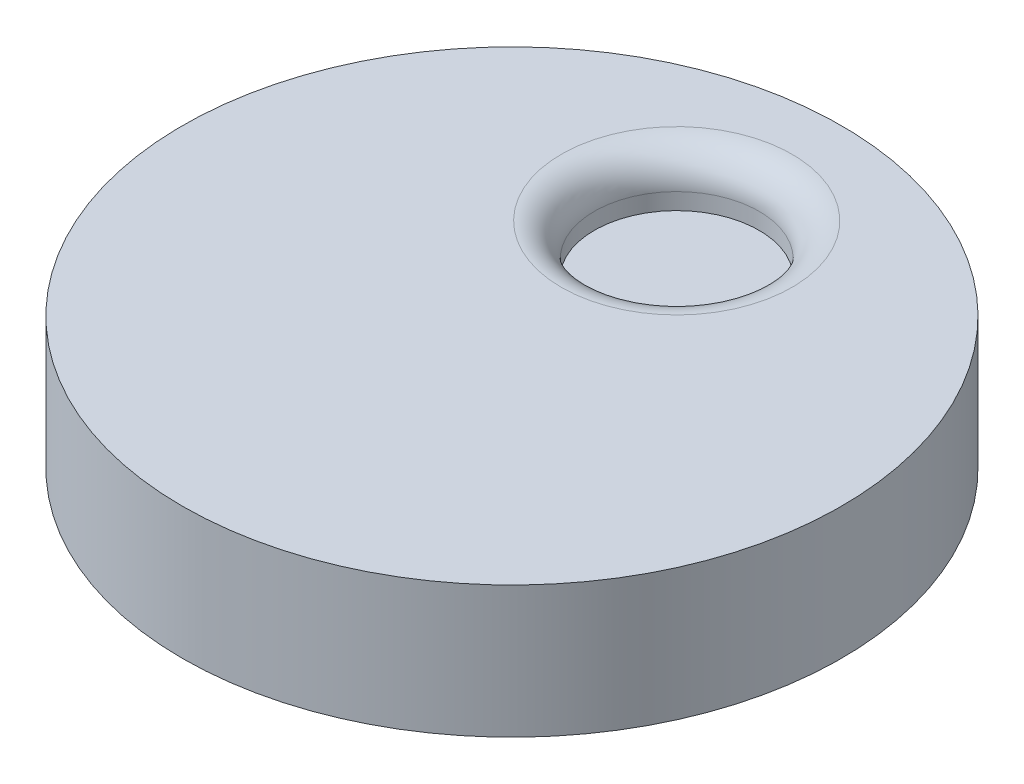
from build123d import *

# Parameters (mm, degrees)
CROQUIS1_R              = 20
SALIENTE_EXTRUIR1_DEPTH = 8
CROQUIS2_R              = 5
CORTAR_EXTRUIR1_DEPTH   = 3
REDONDEO1_R             = 2


with BuildPart() as part:
    # Croquis1 → Saliente-Extruir1 (new body)
    with BuildSketch(Plane(origin=(0, 0, 0), x_dir=(1, 0, 0), z_dir=(0, 1, 0))):
        with Locations(Location((0, 0, 0), (0, 0, 270))):
            Circle(CROQUIS1_R)
    extrude(amount=SALIENTE_EXTRUIR1_DEPTH)

    # Croquis2 → Cortar-Extruir1 (cut)
    with BuildSketch(Plane(origin=(0, 8, 0), x_dir=(1, 0, 0), z_dir=(0, 1, 0))):
        with Locations(Location((0, 10, 0), (0, 0, 270))):
            Circle(CROQUIS2_R)
    extrude(amount=-CORTAR_EXTRUIR1_DEPTH, mode=Mode.SUBTRACT)

    # Redondeo1
    redondeo1_edges = [part.edges().sort_by_distance(p)[0] for p in [
        (0, 8, -15),
    ]]
    fillet(redondeo1_edges, radius=REDONDEO1_R)


solid = part.part
